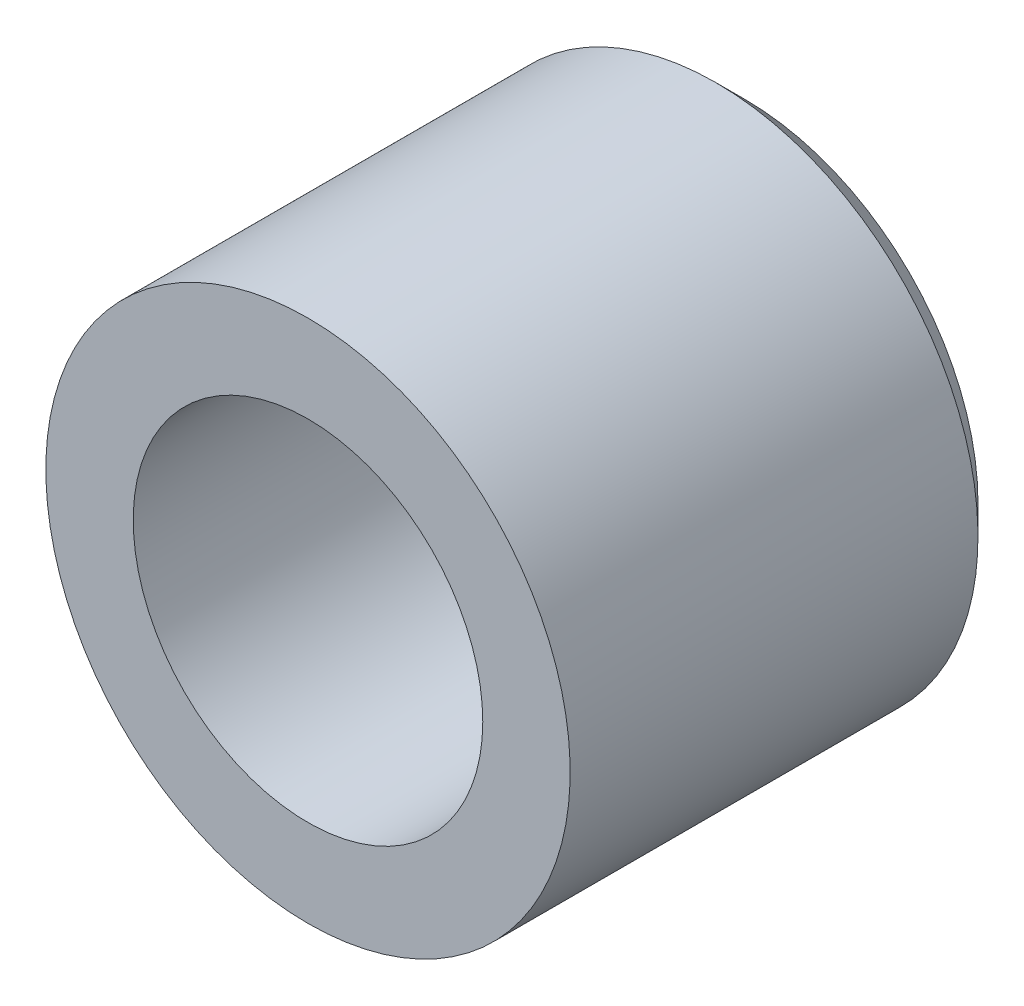
from build123d import *

# Parameters (mm, degrees)
SKETCH_1_W     = 15
SKETCH_1_H     = 3
SKETCH_2_W     = 3
SKETCH_2_H     = 6.5
SKETCH_3_W     = 3
SKETCH_3_H     = 9
CHAMFER_1_SIZE = 1
FILLET_2_R     = 1.5


with BuildPart() as part:
    # 草图1 → 旋转1 (revolve)
    with BuildSketch(Plane(origin=(0, 0, 0), x_dir=(0, 0, -1), z_dir=(1, 0, 0)), mode=Mode.PRIVATE) as revolve_1_sk:
        with Locations((-7.5, -7.5)):
            Rectangle(SKETCH_1_W, SKETCH_1_H)
        Polygon((-15, -9), (-15, -6), (-15, 0), (-18, 0), (-18, -9), align=None)
    revolve(revolve_1_sk.sketch.rotate(Axis((0, 0, 0), (0, 0, 1)), 180), axis=Axis((0, 0, 0), (0, 0, 1)))

    # 草图2 → 切除-旋转1 (revolve, cut)
    with BuildSketch(Plane(origin=(0, 0, 0), x_dir=(0, 0, -1), z_dir=(1, 0, 0)), mode=Mode.PRIVATE) as cut_revolve_1_sk:
        with Locations((-16.5, -3.25)):
            Rectangle(SKETCH_2_W, SKETCH_2_H)
    revolve(cut_revolve_1_sk.sketch.rotate(Axis((0, 0, 18), (0, 0, -1)), 270), axis=Axis((0, 0, 18), (0, 0, -1)), mode=Mode.SUBTRACT)

    # 草图3 → 切除-旋转2 (revolve, cut)
    with BuildSketch(Plane(origin=(0, 0, 0), x_dir=(0, 0, -1), z_dir=(1, 0, 0)), mode=Mode.PRIVATE) as cut_revolve_2_sk:
        with Locations((-16.5, -4.5)):
            Rectangle(SKETCH_3_W, SKETCH_3_H)
    revolve(cut_revolve_2_sk.sketch.rotate(Axis((0, 0, 18), (0, 0, -1)), 180), axis=Axis((0, 0, 18), (0, 0, -1)), mode=Mode.SUBTRACT)

    # 倒角1
    chamfer_1_edges = [part.edges().sort_by_distance(p)[0] for p in [
        (0, -9, 0),
    ]]
    chamfer(chamfer_1_edges, length=CHAMFER_1_SIZE)

    # 圆角2
    fillet_2_edges = [part.edges().sort_by_distance(p)[0] for p in [
        (0, -6, 0),
    ]]
    fillet(fillet_2_edges, radius=FILLET_2_R)


solid = part.part
